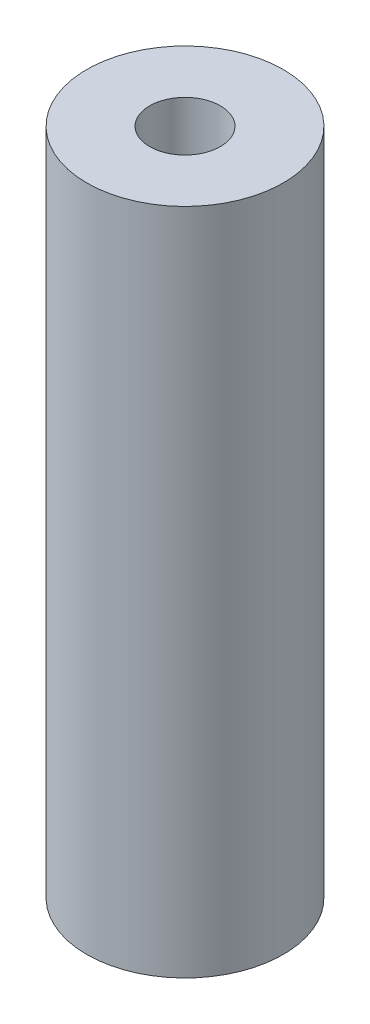
from build123d import *

# Parameters (mm, degrees)
SKETCH_2_R      = 2.5
SKETCH_2_R_2    = 0.9
EXTRUDE_1_DEPTH = 17


with BuildPart() as part:
    # 草图2 → 凸台-拉伸1 (new body)
    with BuildSketch(Plane(origin=(0, 0, 0), x_dir=(1, 0, 0), z_dir=(0, 1, 0))):
        with Locations(Location((0, 0, 0), (0, 0, 270))):
            Circle(SKETCH_2_R)
        with Locations(Location((0, 0, 0), (0, 0, 270))):
            Circle(SKETCH_2_R_2, mode=Mode.SUBTRACT)
    extrude(amount=EXTRUDE_1_DEPTH)


solid = part.part
